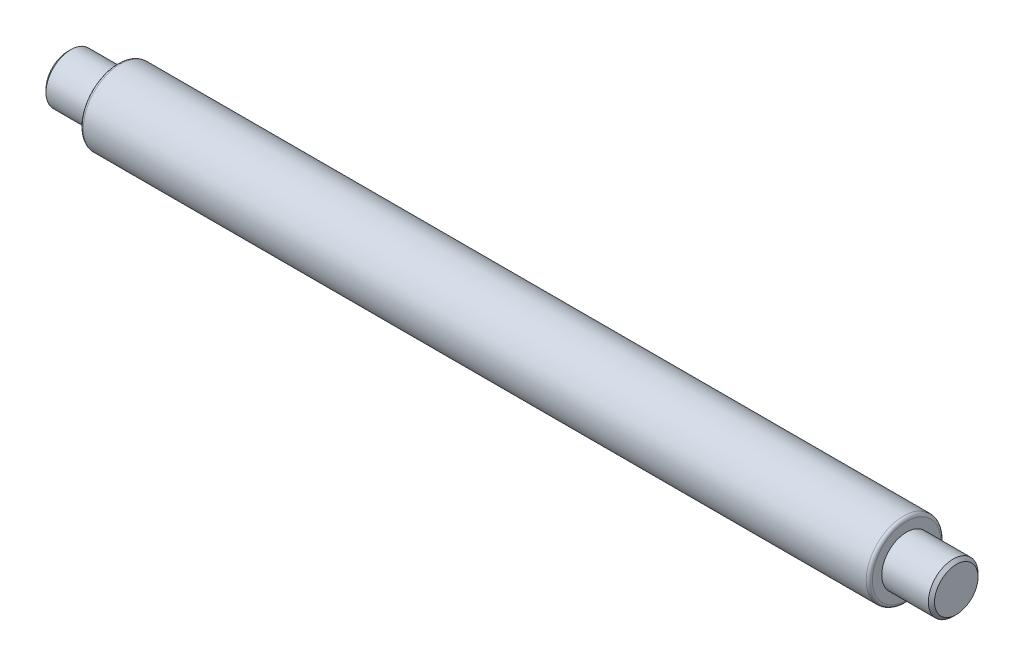
from build123d import *

# Parameters (mm, degrees)
CHAMFER3_SIZE = 0.25
FILLET1_R     = 0.25


with BuildPart() as part:
    # Sketch1 → Revolve1 (revolve)
    with BuildSketch(Plane.XY, mode=Mode.PRIVATE) as revolve1_sk:
        Polygon((-35.75, 0), (-35.75, 2), (-31.75, 2), (-31.75, 3), (31.75, 3), (31.75, 2), (35.75, 2), (35.75, 0), align=None)
    revolve(revolve1_sk.sketch.rotate(Axis((-39.77575721, 0, 0), (1, 0, 0)), 90), axis=Axis((-39.77575721, 0, 0), (1, 0, 0)))

    # Chamfer3
    chamfer3_edges = [part.edges().sort_by_distance(p)[0] for p in [
        (35.75, 0, -2),
        (-35.75, 0, -2),
    ]]
    chamfer(chamfer3_edges, length=CHAMFER3_SIZE)

    # Fillet1
    fillet1_edges = [part.edges().sort_by_distance(p)[0] for p in [
        (31.75, 0, -3),
        (-31.75, 0, -3),
    ]]
    fillet(fillet1_edges, radius=FILLET1_R)


solid = part.part
